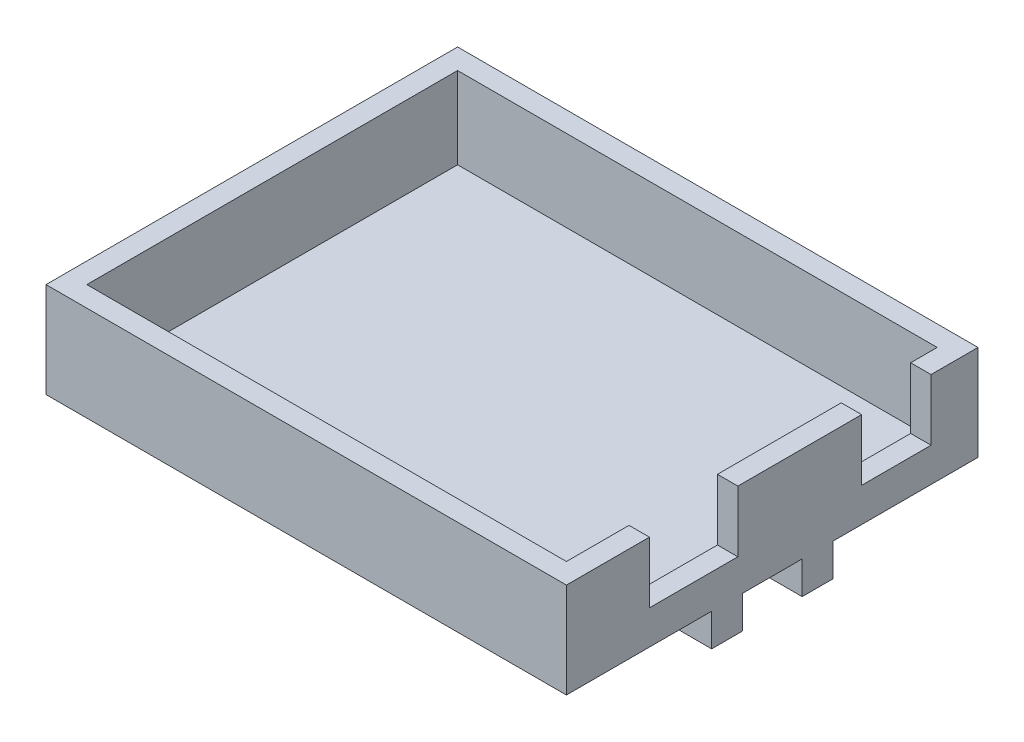
from build123d import *

# Parameters (mm, degrees)
SKETCH1_W           = 76.5
SKETCH1_H           = 60.5
BOSS_EXTRUDE1_DEPTH = 14
SKETCH2_W           = 70.5
SKETCH2_H           = 54.5
CUT_EXTRUDE1_DEPTH  = 12
CUT_EXTRUDE2_REACH  = 85.446
SKETCH4_W           = 13
SKETCH4_H           = 9
SKETCH4_W_2         = 10.2
SKETCH5_W           = 76.5
SKETCH5_H           = 4.5
BOSS_EXTRUDE3_DEPTH = 4.8


with BuildPart() as part:
    # Sketch1 → Boss-Extrude1 (new body)
    with BuildSketch(Plane(origin=(0, 0, 0), x_dir=(1, 0, 0), z_dir=(0, 1, 0))):
        Rectangle(SKETCH1_W, SKETCH1_H)
    extrude(amount=BOSS_EXTRUDE1_DEPTH)

    # Sketch2 → Cut-Extrude1 (cut)
    with BuildSketch(Plane(origin=(0, 14, 0), x_dir=(1, 0, 0), z_dir=(0, 1, 0))):
        Rectangle(SKETCH2_W, SKETCH2_H)
    extrude(amount=-CUT_EXTRUDE1_DEPTH, mode=Mode.SUBTRACT)

    # Sketch4 → Cut-Extrude2 (cut, up to next)
    with BuildSketch(Plane(origin=(38.25, 0, 0), x_dir=(0, 0, -1), z_dir=(1, 0, 0)), mode=Mode.PRIVATE) as cut_extrude2_sk1:
        with Locations((-11.55, 9.5)):
            Rectangle(SKETCH4_W, SKETCH4_H)
    cut_extrude2_tool1 = extrude(cut_extrude2_sk1.sketch, amount=-CUT_EXTRUDE2_REACH, mode=Mode.PRIVATE) & part.part
    # Sketch4 → Cut-Extrude2 (cut, up to next)
    with BuildSketch(Plane(origin=(38.25, 0, 0), x_dir=(0, 0, -1), z_dir=(1, 0, 0)), mode=Mode.PRIVATE) as cut_extrude2_sk2:
        with Locations((18.25, 9.5)):
            Rectangle(SKETCH4_W_2, SKETCH4_H)
    cut_extrude2_tool2 = extrude(cut_extrude2_sk2.sketch, amount=-CUT_EXTRUDE2_REACH, mode=Mode.PRIVATE) & part.part
    add(cut_extrude2_tool1.solids().sort_by_distance((38.25, 9.5, 11.55))[0], mode=Mode.SUBTRACT)
    add(cut_extrude2_tool2.solids().sort_by_distance((38.25, 9.5, -18.25))[0], mode=Mode.SUBTRACT)

    # Sketch5 → Boss-Extrude3 (add)
    with BuildSketch(Plane.XZ):
        with Locations((0, 6.65)):
            Rectangle(SKETCH5_W, SKETCH5_H)
    boss_extrude3 = extrude(amount=BOSS_EXTRUDE3_DEPTH)

    # Mirror1: Boss-Extrude3 across plane
    add(boss_extrude3.mirror(Plane.XY))


solid = part.part
